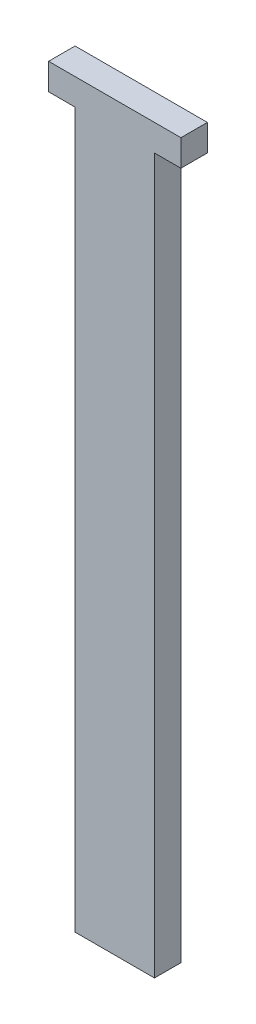
from build123d import *

# Parameters (mm, degrees)
BOSS_EXTRUDE1_DEPTH = 5


with BuildPart() as part:
    # Sketch1 → Boss-Extrude1 (new body)
    with BuildSketch(Plane.XY):
        Polygon((-12.519230769, 47.788461538), (-7.519230769, 47.788461538), (-7.519230769, 52.788461538), (-32.519230769, 52.788461538), (-32.519230769, 47.788461538), (-27.519230769, 47.788461538), (-27.519230769, -87.211538462), (-12.519230769, -87.211538462), align=None)
    extrude(amount=BOSS_EXTRUDE1_DEPTH)


solid = part.part
